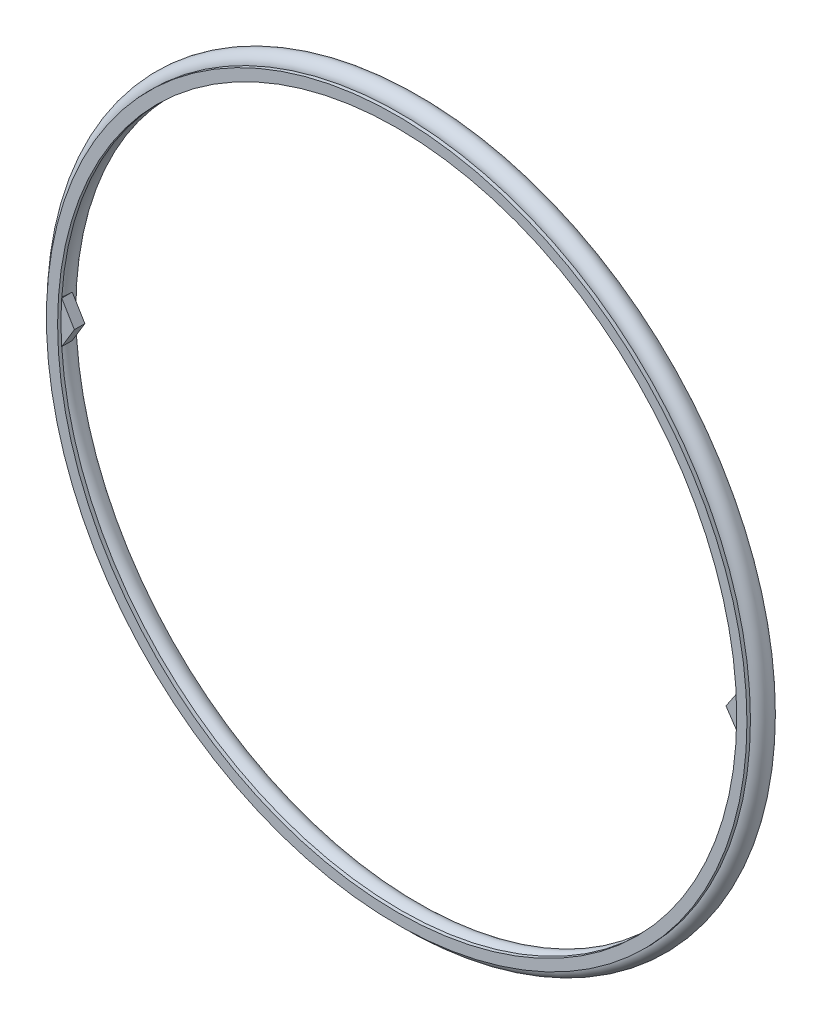
from build123d import *

# Parameters (mm, degrees)
SKETCH1_R             = 2.921
BOSS_EXTRUDE1_DEPTH   = 3
BOSS_EXTRUDE1_2_DEPTH = 3
BOSS_EXTRUDE2_DEPTH   = 1
CUT_EXTRUDE1_DEPTH    = 1


with BuildPart() as part:
    # Sketch1 → Revolve1 (revolve)
    with BuildSketch(Plane(origin=(0, 0, 0), x_dir=(1, 0, 0), z_dir=(0, 1, 0)), mode=Mode.PRIVATE) as revolve1_sk:
        Circle(SKETCH1_R)
    revolve(revolve1_sk.sketch.rotate(Axis((-99.949, 0, -55.65970583), (0, 0, 1)), 180), axis=Axis((-99.949, 0, -55.65970583), (0, 0, 1)))


with BuildPart() as body_2:
    # Sketch2 → Boss-Extrude1 (new body)
    with BuildSketch(Plane.XY):
        with BuildLine():
            Line((-196.791685189, 5.993922712), (-193.176039945, 0))
            Line((-193.176039945, 0), (-196.791685189, -5.993922712))
            ThreePointArc((-196.791685189, -5.993922712), (-200.176039945, 0), (-196.791685189, 5.993922712))
        make_face()
    extrude(amount=BOSS_EXTRUDE1_DEPTH)



with BuildPart() as body_3:
    # Sketch2 → Boss-Extrude1 2 (new body)
    with BuildSketch(Plane.XY):
        with BuildLine():
            Line((-3.095083417, 5.809615003), (-7, 0))
            Line((-7, 0), (-3.095083417, -5.809615003))
            ThreePointArc((-3.095083417, -5.809615003), (0, 0), (-3.095083417, 5.809615003))
        make_face()
    extrude(amount=BOSS_EXTRUDE1_2_DEPTH)


with BuildPart() as body_2_1:
    add(body_2.part)

    add(body_3.part)  # Boss-Extrude2 merges body 3
    # Sketch5 → Boss-Extrude2 (add)
    with BuildSketch(Plane.XY.offset(3)):
        with BuildLine():
            ThreePointArc((-200.176039945, 0), (-100.088019973, 100.088019973), (0, 0))
            ThreePointArc((0, 0), (-100.088019973, -100.088019973), (-200.176039945, 0))
        make_face()
    extrude(amount=BOSS_EXTRUDE2_DEPTH)

    # Sketch8 → Cut-Extrude1 (cut)
    with BuildSketch(Plane(origin=(0, 0, 3), x_dir=(-1, 0, 0), z_dir=(0, 0, -1))):
        with BuildLine():
            ThreePointArc((2.921, 0), (99.949, 97.028), (196.977, 0))
            ThreePointArc((196.977, 0), (99.949, -97.028), (2.921, 0))
        make_face()
    extrude(amount=-CUT_EXTRUDE1_DEPTH, mode=Mode.SUBTRACT)


solid = Compound([part.part, body_2_1.part])
